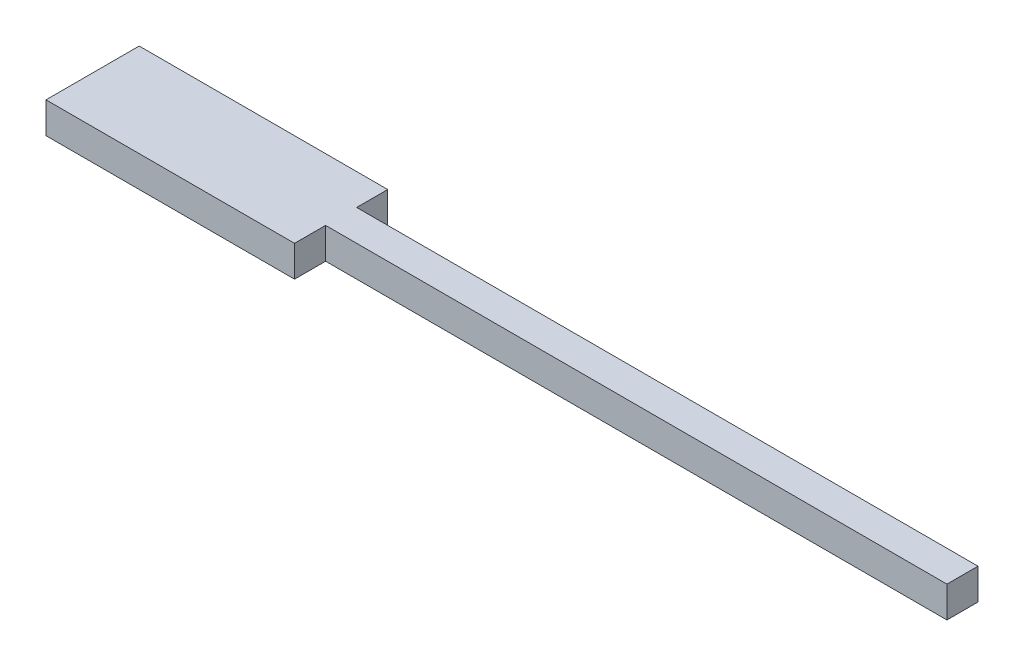
from build123d import *

# Parameters (mm, degrees)
BOSS_EXTRUDE1_DEPTH = 5


with BuildPart() as part:
    # Sketch1 → Boss-Extrude1 (new body)
    with BuildSketch(Plane(origin=(0, 0, 0), x_dir=(1, 0, 0), z_dir=(0, 1, 0))):
        Polygon((0, 15), (0, 10), (100, 10), (100, 5), (0, 5), (0, 0), (-40, 0), (-40, 15), align=None)
    extrude(amount=BOSS_EXTRUDE1_DEPTH)


solid = part.part
